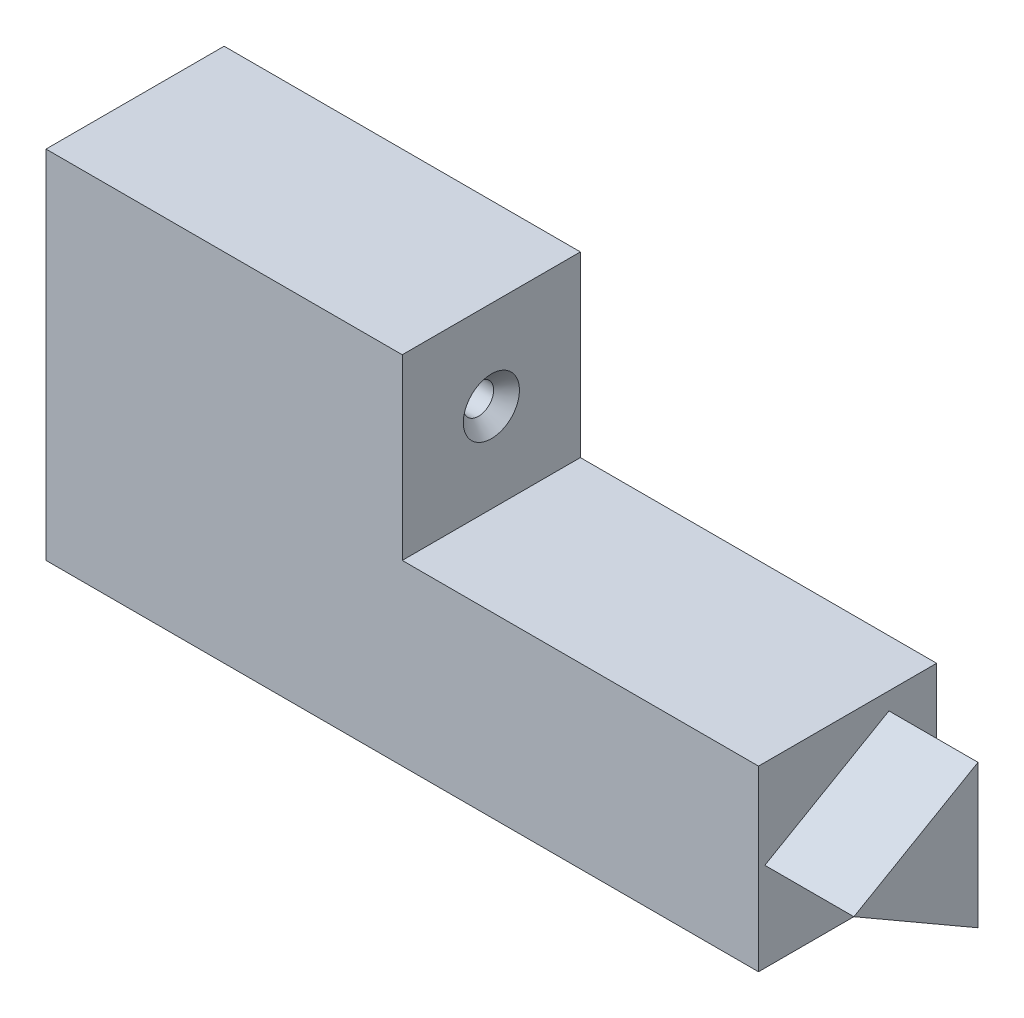
from build123d import *

# Parameters (mm, degrees)
SKETCH_1_W                  = 20
SKETCH_1_H                  = 40
EXTRUDE_1_DEPTH             = 40
SKETCH_16_W                 = 20
SKETCH_16_H                 = 20
EXTRUDE_2_DEPTH             = 40
HOLE_WIZARD_M31_D           = 3.4
HOLE_WIZARD_M31_CSINK_D     = 6.3
HOLE_WIZARD_M31_CSINK_ANGLE = 90
EXTRUDE_3_DEPTH             = 10


with BuildPart() as part:
    # Эскиз1 → Бобышка-Вытянуть1 (new body)
    with BuildSketch(Plane(origin=(0, 0, 0), x_dir=(0, 0, -1), z_dir=(1, 0, 0))):
        with Locations((-27.72412662, 2.360988518)):
            Rectangle(SKETCH_1_W, SKETCH_1_H)
    extrude(amount=EXTRUDE_1_DEPTH)

    # Эскиз16 → Бобышка-Вытянуть2 (add)
    with BuildSketch(Plane(origin=(40, 0, 0), x_dir=(0, 0, -1), z_dir=(1, 0, 0))):
        with Locations((-27.72412662, -7.639011482)):
            Rectangle(SKETCH_16_W, SKETCH_16_H)
    extrude(amount=EXTRUDE_2_DEPTH)

    # Зенковка для винта с полупотайной головкой M31 (through all)
    with Locations(Plane(origin=(40, 0, 0), x_dir=(0, 0, -1), z_dir=(1, 0, 0))):
        with Locations((-27.717933157, 12.344098424)):
            CounterSinkHole(HOLE_WIZARD_M31_D / 2, HOLE_WIZARD_M31_CSINK_D / 2, counter_sink_angle=HOLE_WIZARD_M31_CSINK_ANGLE)

    # Эскиз19 → Бобышка-Вытянуть3 (add)
    with BuildSketch(Plane(origin=(80, 0, 0), x_dir=(0, 0, -1), z_dir=(1, 0, 0))):
        Polygon((-37.01304766, -7.639011482), (-23.0796661, -15.683453077), (-23.0796661, 0.405430112), align=None)
    extrude(amount=EXTRUDE_3_DEPTH)


solid = part.part
